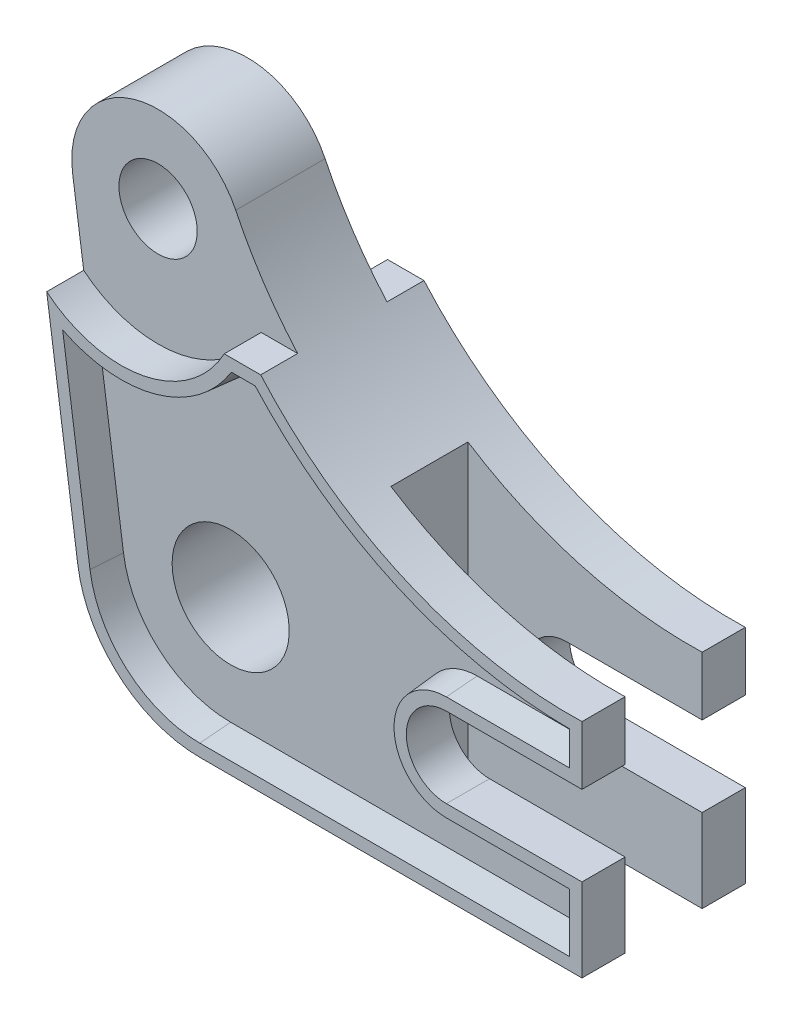
from build123d import *

# Parameters (mm, degrees)
SKETCH1_R           = 9.5
SKETCH1_R_2         = 6.35
BOSS_EXTRUDE1_DEPTH = 26.5
SKETCH2_W           = 38
SKETCH2_H           = 12.5
CUT_EXTRUDE1_DEPTH  = 106.917446478
CUT_EXTRUDE3_START  = -6
CUT_EXTRUDE3_DEPTH  = 6
SKETCH6_R           = 6.35
CUT_EXTRUDE4_DEPTH  = 6
CUT_EXTRUDE6_DEPTH  = 5
CUT_EXTRUDE6_DRAFT  = -5
CUT_EXTRUDE7_DEPTH  = 5
CUT_EXTRUDE7_DRAFT  = -5


with BuildPart() as part:
    # Sketch1 → Boss-Extrude1 (new body)
    with BuildSketch(Plane.XY):
        with BuildLine():
            ThreePointArc((-19.80444005, 17.20999027), (-13.118685251, 4.903639601), (0, 0))
            Line((0, 0), (62, 0))
            Line((62, 0), (62, 13.5))
            Line((62, 13.5), (40, 13.5))
            ThreePointArc((40, 13.5), (33.5, 20), (40, 26.5))
            Line((40, 26.5), (62, 26.5))
            Line((62, 26.5), (62, 36.026416032))
            ThreePointArc((62, 36.026416032), (25.339969654, 45.733644305), (-0.177612992, 73.787896774))
            ThreePointArc((-0.177612992, 73.787896774), (-16.854632867, 81.076848535), (-26.639963888, 65.730868394))
            Line((-26.639963888, 65.730868394), (-19.80444005, 17.20999027))
        make_face()
        with Locations((0, 20)):
            Circle(SKETCH1_R, mode=Mode.SUBTRACT)
        with Locations((-12.776855853, 67.683875204)):
            Circle(SKETCH1_R_2, mode=Mode.SUBTRACT)
    extrude(amount=BOSS_EXTRUDE1_DEPTH)

    # Sketch2 → Cut-Extrude1 (cut, through all)
    with BuildSketch(Plane(origin=(0, 0, 0), x_dir=(1, 0, 0), z_dir=(0, 1, 0))):
        with Locations((43, -13.25)):
            Rectangle(SKETCH2_W, SKETCH2_H)
    extrude(amount=CUT_EXTRUDE1_DEPTH, mode=Mode.SUBTRACT)

    # Sketch3 → Cut-Extrude3 (cut)
    with BuildSketch(Plane.XY.offset(26.5).offset(CUT_EXTRUDE3_START)):
        with BuildLine():
            Line((3.956344678, 58.683875204), (9.868578653, 58.683875204))
            ThreePointArc((9.868578653, 58.683875204), (4.331951234, 65.89431889), (-0.177612992, 73.787896774))
            ThreePointArc((-0.177612992, 73.787896774), (-16.854632867, 81.076848535), (-26.639963888, 65.730868394))
            Line((-26.639963888, 65.730868394), (-24.848047694, 53.011236467))
            ThreePointArc((-24.848047694, 53.011236467), (-9.105576946, 49.041940992), (3.956344678, 58.683875204))
        make_face()
    extrude(amount=CUT_EXTRUDE3_DEPTH, mode=Mode.SUBTRACT)

    # Sketch6 → Cut-Extrude4 (cut)
    with BuildSketch(Plane(origin=(0, 0, 0), x_dir=(-1, 0, 0), z_dir=(0, 0, -1))):
        with BuildLine():
            Line((-9.868578653, 58.683875204), (-3.956344678, 58.683875204))
            ThreePointArc((-3.956344678, 58.683875204), (9.105576946, 49.041940992), (24.848047694, 53.011236467))
            Line((24.848047694, 53.011236467), (26.639963888, 65.730868394))
            ThreePointArc((26.639963888, 65.730868394), (16.854632867, 81.076848535), (0.177612992, 73.787896774))
            ThreePointArc((0.177612992, 73.787896774), (-4.331951234, 65.89431889), (-9.868578653, 58.683875204))
        make_face()
        with Locations((12.776855853, 67.683875204)):
            Circle(SKETCH6_R, mode=Mode.SUBTRACT)
    extrude(amount=-CUT_EXTRUDE4_DEPTH, mode=Mode.SUBTRACT)


with BuildPart() as cut_extrude6_tool:
    # Sketch7 → Cut-Extrude6 (with draft: the straight prism first)
    with BuildSketch(Plane.XY.offset(26.5)):
        with BuildLine():
            Line((8.973709214, 56.683875204), (5.111687967, 56.683875204))
            ThreePointArc((5.111687967, 56.683875204), (-7.062338313, 47.476344695), (-22.255412032, 48.944692384))
            Line((-22.255412032, 48.944692384), (-17.823996045, 17.488991243))
            ThreePointArc((-17.823996045, 17.488991243), (-11.806816725, 6.413275641), (0, 2))
            Line((0, 2), (60, 2))
            Line((60, 2), (60, 11.5))
            Line((60, 11.5), (40, 11.5))
            ThreePointArc((40, 11.5), (31.5, 20), (40, 28.5))
            Line((40, 28.5), (60, 28.5))
            Line((60, 28.5), (60, 34.000102209))
            ThreePointArc((60, 34.000102209), (32.089615412, 39.94948966), (8.973709214, 56.683875204))
        make_face()
    extrude(amount=-CUT_EXTRUDE6_DEPTH)
    # Cut-Extrude6: the draft: its side faces are tilted about the plane it starts from
    cut_extrude6_sides = [cut_extrude6_tool.faces().sort_by_distance(p)[0] for p in [
        (7.042698591, 56.683875204, 24),
        (-7.062338313, 47.476344695, 24),
        (-20.039704038, 33.216841814, 24),
        (-11.806816725, 6.413275641, 24),
        (30, 2, 24),
        (60, 6.75, 24),
        (50, 11.5, 24),
        (31.5, 20, 24),
        (50, 28.5, 24),
        (60, 31.250051104, 24),
        (32.089615412, 39.94948966, 24),
    ]]
    draft(cut_extrude6_sides, Plane.XY.offset(26.5), CUT_EXTRUDE6_DRAFT)


with BuildPart() as part_1:
    add(part.part)

    # Cut-Extrude6: cut by cut_extrude6_tool
    add(cut_extrude6_tool.part, mode=Mode.SUBTRACT)


with BuildPart() as cut_extrude7_tool:
    # Sketch8 → Cut-Extrude7 (with draft: the straight prism first)
    with BuildSketch(Plane(origin=(0, 0, 0), x_dir=(-1, 0, 0), z_dir=(0, 0, -1))):
        with BuildLine():
            Line((-5.111687967, 56.683875204), (-8.973709214, 56.683875204))
            ThreePointArc((-8.973709214, 56.683875204), (-32.089615412, 39.94948966), (-60, 34.000102209))
            Line((-60, 34.000102209), (-60, 28.5))
            Line((-60, 28.5), (-40, 28.5))
            ThreePointArc((-40, 28.5), (-31.5, 20), (-40, 11.5))
            Line((-40, 11.5), (-60, 11.5))
            Line((-60, 11.5), (-60, 2))
            Line((-60, 2), (0, 2))
            ThreePointArc((0, 2), (11.806816725, 6.413275641), (17.823996045, 17.488991243))
            Line((17.823996045, 17.488991243), (22.255412032, 48.944692384))
            ThreePointArc((22.255412032, 48.944692384), (7.062338313, 47.476344695), (-5.111687967, 56.683875204))
        make_face()
    extrude(amount=-CUT_EXTRUDE7_DEPTH)
    # Cut-Extrude7: the draft: its side faces are tilted about the plane it starts from
    cut_extrude7_sides = [cut_extrude7_tool.faces().sort_by_distance(p)[0] for p in [
        (7.042698591, 56.683875204, 2.5),
        (32.089615412, 39.94948966, 2.5),
        (60, 31.250051104, 2.5),
        (50, 28.5, 2.5),
        (31.5, 20, 2.5),
        (50, 11.5, 2.5),
        (60, 6.75, 2.5),
        (30, 2, 2.5),
        (-11.806816725, 6.413275641, 2.5),
        (-20.039704038, 33.216841814, 2.5),
        (-7.062338313, 47.476344695, 2.5),
    ]]
    draft(cut_extrude7_sides, Plane(origin=(0, 0, 0), x_dir=(-1, 0, 0), z_dir=(0, 0, -1)), CUT_EXTRUDE7_DRAFT)


with BuildPart() as part_2:
    add(part_1.part)

    # Cut-Extrude7: cut by cut_extrude7_tool
    add(cut_extrude7_tool.part, mode=Mode.SUBTRACT)


solid = part_2.part
